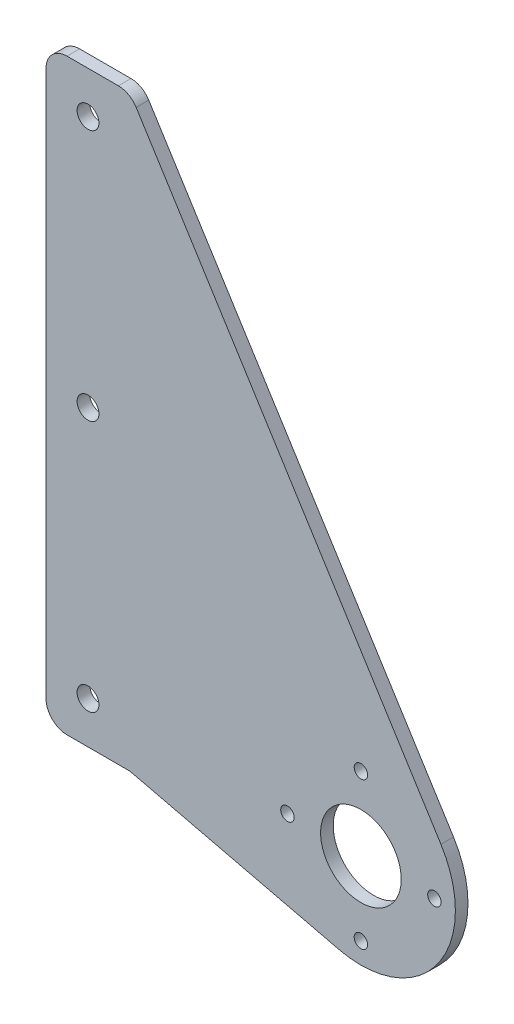
from build123d import *

# Parameters (mm, degrees)
SKETCH_2_R      = 9.6
SKETCH_2_R_2    = 1.6
SKETCH_2_R_3    = 2.6
EXTRUDE_1_DEPTH = 3
FILLET_3_R      = 5


with BuildPart() as part:
    # ｽｹｯﾁ2 → ﾎﾞｽ - 押し出し1 (new body)
    with BuildSketch(Plane.XY):
        with BuildLine():
            Line((-75, 130), (-75, -10))
            Line((-75, -10), (-55, -10))
            Line((-55, -10), (-5.225491892, -21.884794596))
            ThreePointArc((-5.225491892, -21.884794596), (18.280450485, -13.117741043), (19.059394587, 11.957820787))
            Line((19.059394587, 11.957820787), (-55, 130))
            Line((-55, 130), (-75, 130))
        make_face()
        Circle(SKETCH_2_R, mode=Mode.SUBTRACT)
        with Locations((0, 17.5)):
            Circle(SKETCH_2_R_2, mode=Mode.SUBTRACT)
        with Locations((17.5, 0)):
            Circle(SKETCH_2_R_2, mode=Mode.SUBTRACT)
        with Locations((0, -17.5)):
            Circle(SKETCH_2_R_2, mode=Mode.SUBTRACT)
        with Locations((-17.5, 0)):
            Circle(SKETCH_2_R_2, mode=Mode.SUBTRACT)
        with Locations((-65, 60)):
            Circle(SKETCH_2_R_3, mode=Mode.SUBTRACT)
        with Locations((-65, 120)):
            Circle(SKETCH_2_R_3, mode=Mode.SUBTRACT)
        with Locations((-65, 0)):
            Circle(SKETCH_2_R_3, mode=Mode.SUBTRACT)
    extrude(amount=EXTRUDE_1_DEPTH)

    # ﾌｨﾚｯﾄ3
    fillet_3_edges = [part.edges().sort_by_distance(p)[0] for p in [
        (-55, 130, 1.5),
        (-55, -10, 1.5),
        (-75, -10, 1.5),
        (-75, 130, 1.5),
    ]]
    fillet(fillet_3_edges, radius=FILLET_3_R)


solid = part.part
